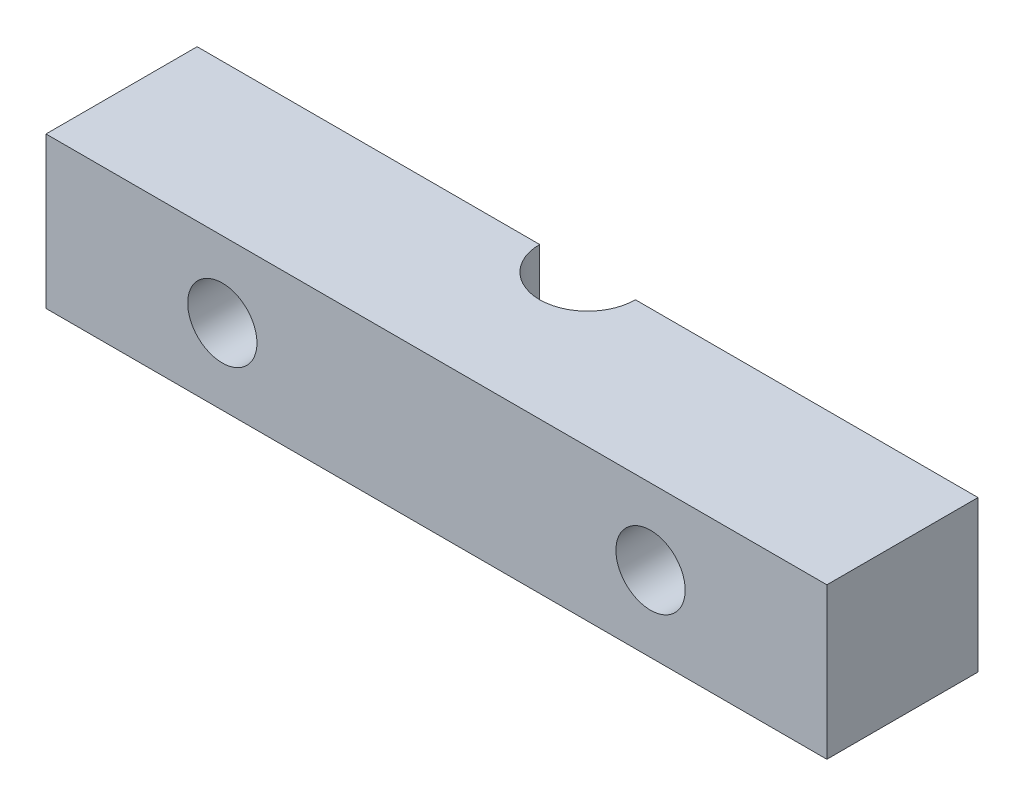
from build123d import *

# Parameters (mm, degrees)
SKETCH1_W        = 31
SKETCH1_H        = 6
SKETCH1_R        = 1.375
BASE_DEPTH       = 6
WIRE_GROVE_DEPTH = 18.670597047


with BuildPart() as part:
    # Sketch1 → Base (new body)
    with BuildSketch(Plane.XY):
        Rectangle(SKETCH1_W, SKETCH1_H)
        with Locations((-8.5, 0)):
            Circle(SKETCH1_R, mode=Mode.SUBTRACT)
        with Locations((8.5, 0)):
            Circle(SKETCH1_R, mode=Mode.SUBTRACT)
    extrude(amount=BASE_DEPTH)

    # Sketch2 → Wire Grove (cut, through all)
    with BuildSketch(Plane(origin=(0, 3, 0), x_dir=(1, 0, 0), z_dir=(0, 1, 0))):
        with BuildLine():
            Line((-1.9, 0), (1.9, 0))
            ThreePointArc((1.9, 0), (0, -1.9), (-1.9, 0))
        make_face()
    extrude(amount=-WIRE_GROVE_DEPTH, mode=Mode.SUBTRACT)


solid = part.part
